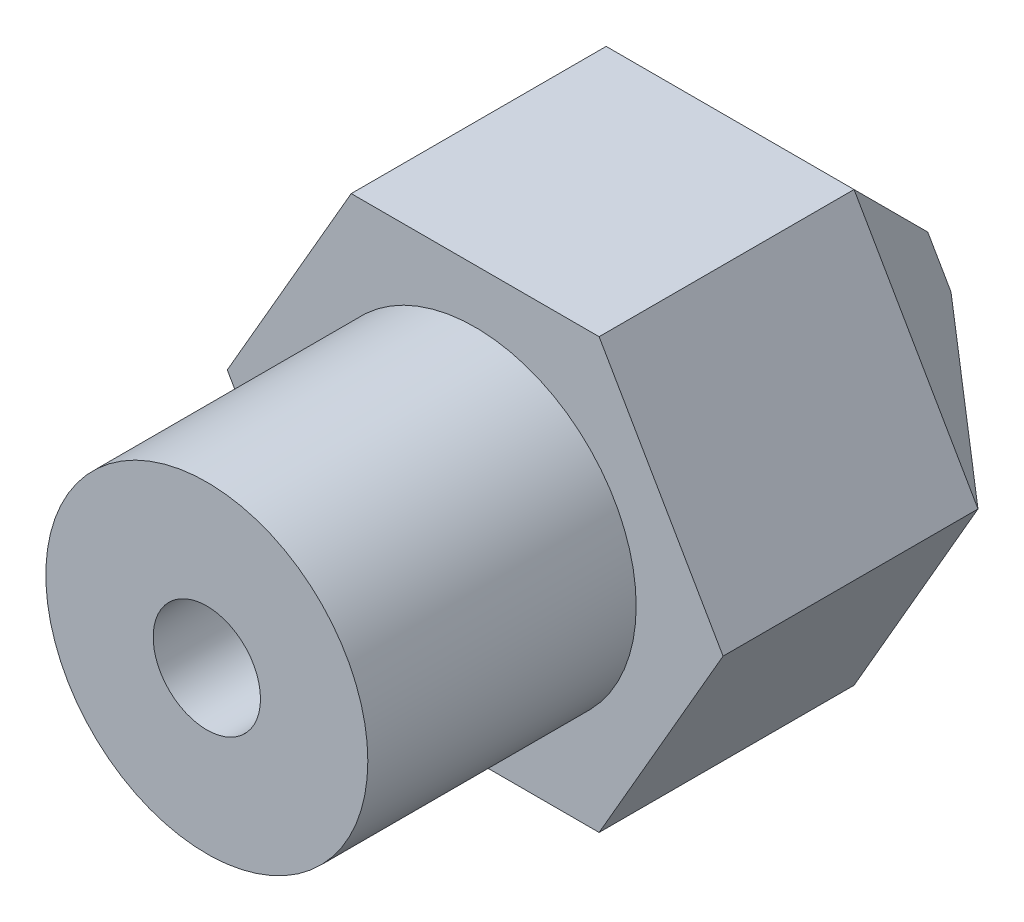
from build123d import *

# Parameters (mm, degrees)
BOSS_EXTRU_1_DEPTH                  = 13
ESQUISSE4_W                         = 12.119923514
ESQUISSE4_H                         = 8.864443631
ESQUISSE4_R                         = 3
ENL_V_MAT_EXTRU_1_DEPTH             = 5
CHANFREIN1_SIZE                     = 3.25
DIAM_TRE_DU_PER_AGE_1_5_1_5_1_D     = 1.5
DIAM_TRE_DU_PER_AGE_1_5_1_5_1_DEPTH = 12.1
DIAM_TRE_DU_PER_AGE_1_5_1_5_1_TIP   = 0.450645464
DIAM_TRE_DU_PER_AGE_2_0_2_1_D       = 2
DIAM_TRE_DU_PER_AGE_2_0_2_1_DEPTH   = 10.6
DIAM_TRE_DU_PER_AGE_2_0_2_1_TIP     = 0.600860619
DIAM_TRE_DU_PER_AGE_0_4_0_4_1_D     = 0.4
DIAM_TRE_DU_PER_AGE_0_4_0_4_1_DEPTH = 1
DIAM_TRE_DU_PER_AGE_0_4_0_4_1_TIP   = 0.120172124


with BuildPart() as part:
    # Esquisse1 → Boss.-Extru.1 (new body)
    with BuildSketch(Plane.XY):
        Polygon((4.618802154, 0), (2.309401077, 4), (-2.309401077, 4), (-4.618802154, 0), (-2.309401077, -4), (2.309401077, -4), align=None)
    extrude(amount=BOSS_EXTRU_1_DEPTH)

    # Esquisse4 → Enlèv. mat.-Extru.1 (cut)
    with BuildSketch(Plane.XY.offset(13)):
        with Locations((0.347320306, 0.072574392)):
            Rectangle(ESQUISSE4_W, ESQUISSE4_H)
        Circle(ESQUISSE4_R, mode=Mode.SUBTRACT)
    extrude(amount=-ENL_V_MAT_EXTRU_1_DEPTH, mode=Mode.SUBTRACT)

    # Chanfrein1
    chanfrein1_edges = [part.edges().sort_by_distance(p)[0] for p in [
        (0, -4, 0),
        (-3.464101615, -2, 0),
        (-3.464101615, 2, 0),
        (0, 4, 0),
        (3.464101615, 2, 0),
        (3.464101615, -2, 0),
    ]]
    chamfer(chanfrein1_edges, length=CHANFREIN1_SIZE)

    # Diamètre du perçage Ø1.5 (1.5)1
    with Locations(Plane.XY.offset(13)):
        with Locations((0, 0)):
            Hole(DIAM_TRE_DU_PER_AGE_1_5_1_5_1_D / 2, depth=DIAM_TRE_DU_PER_AGE_1_5_1_5_1_DEPTH)
            with Locations((0, 0, -(DIAM_TRE_DU_PER_AGE_1_5_1_5_1_DEPTH + DIAM_TRE_DU_PER_AGE_1_5_1_5_1_TIP / 2))):  # 118° drill point
                Cone(0, DIAM_TRE_DU_PER_AGE_1_5_1_5_1_D / 2, DIAM_TRE_DU_PER_AGE_1_5_1_5_1_TIP, mode=Mode.SUBTRACT)

    # Diamètre du perçage Ø2.0 (2)1
    with Locations(Plane.XY.offset(13)):
        with Locations((0, 0)):
            Hole(DIAM_TRE_DU_PER_AGE_2_0_2_1_D / 2, depth=DIAM_TRE_DU_PER_AGE_2_0_2_1_DEPTH)
            with Locations((0, 0, -(DIAM_TRE_DU_PER_AGE_2_0_2_1_DEPTH + DIAM_TRE_DU_PER_AGE_2_0_2_1_TIP / 2))):  # 118° drill point
                Cone(0, DIAM_TRE_DU_PER_AGE_2_0_2_1_D / 2, DIAM_TRE_DU_PER_AGE_2_0_2_1_TIP, mode=Mode.SUBTRACT)

    # Diamètre du perçage Ø0.4 (0.4)1
    with Locations(Plane(origin=(0, 0, 0), x_dir=(-1, 0, 0), z_dir=(0, 0, -1))):
        with Locations((0, 0)):
            Hole(DIAM_TRE_DU_PER_AGE_0_4_0_4_1_D / 2, depth=DIAM_TRE_DU_PER_AGE_0_4_0_4_1_DEPTH)
            with Locations((0, 0, -(DIAM_TRE_DU_PER_AGE_0_4_0_4_1_DEPTH + DIAM_TRE_DU_PER_AGE_0_4_0_4_1_TIP / 2))):  # 118° drill point
                Cone(0, DIAM_TRE_DU_PER_AGE_0_4_0_4_1_D / 2, DIAM_TRE_DU_PER_AGE_0_4_0_4_1_TIP, mode=Mode.SUBTRACT)


solid = part.part
